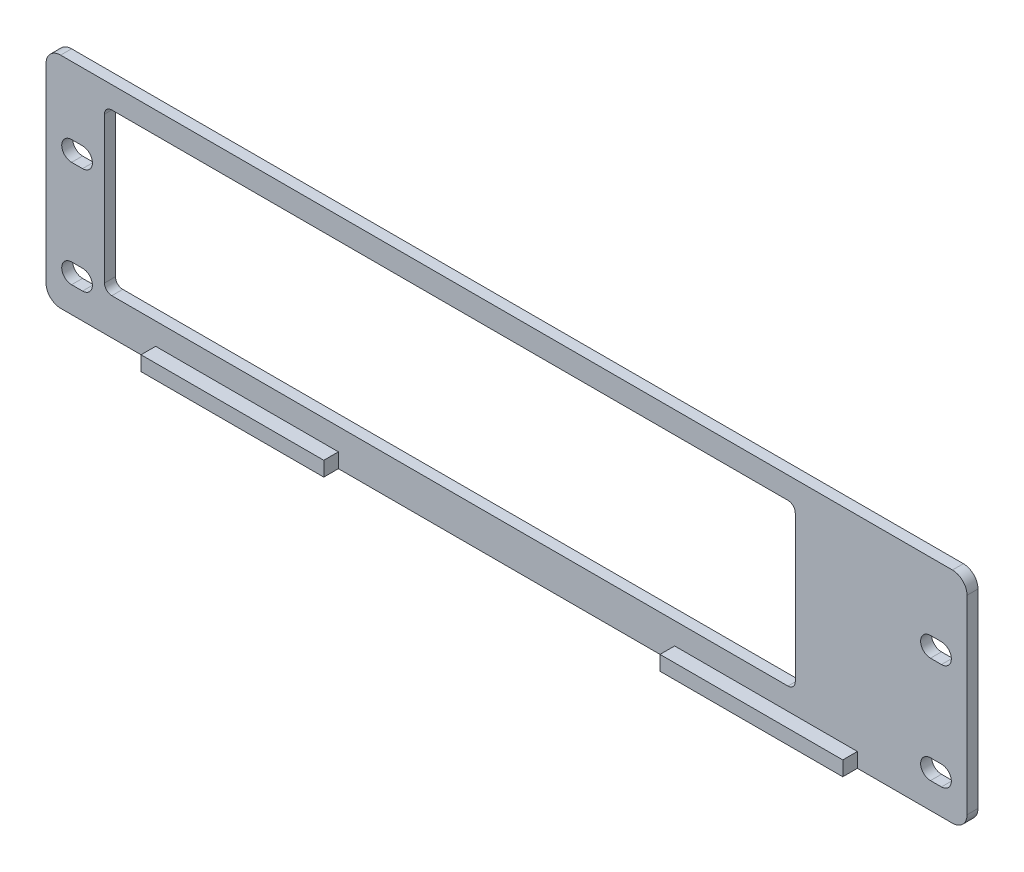
from build123d import *

# Parameters (mm, degrees)
SKETCH1_W           = 252
SKETCH1_H           = 60
BOSS_EXTRUDE1_DEPTH = 3
SKETCH3_W           = 50
SKETCH3_H           = 4
BOSS_EXTRUDE3_DEPTH = 4
SKETCH4_W           = 189
SKETCH4_H           = 44
CUT_EXTRUDE1_DEPTH  = 4
FILLET1_R           = 4
FILLET3_R           = 2


with BuildPart() as part:
    # Sketch1 → Boss-Extrude1 (new body)
    with BuildSketch(Plane.XY):
        with Locations((126, 30)):
            Rectangle(SKETCH1_W, SKETCH1_H)
        with BuildLine():
            Line((245, 36.1), (242, 36.1))
            ThreePointArc((242, 36.1), (239.3, 38.8), (242, 41.5))
            Line((242, 41.5), (245, 41.5))
            ThreePointArc((245, 41.5), (247.7, 38.8), (245, 36.1))
        make_face(mode=Mode.SUBTRACT)
        with BuildLine():
            Line((242, 12.5), (245, 12.5))
            ThreePointArc((245, 12.5), (247.7, 9.8), (245, 7.1))
            Line((245, 7.1), (242, 7.1))
            ThreePointArc((242, 7.1), (239.3, 9.8), (242, 12.5))
        make_face(mode=Mode.SUBTRACT)
        with BuildLine():
            Line((7, 41.5), (10, 41.5))
            ThreePointArc((10, 41.5), (12.7, 38.8), (10, 36.1))
            Line((10, 36.1), (7, 36.1))
            ThreePointArc((7, 36.1), (4.3, 38.8), (7, 41.5))
        make_face(mode=Mode.SUBTRACT)
        with BuildLine():
            Line((7, 12.5), (10, 12.5))
            ThreePointArc((10, 12.5), (12.7, 9.8), (10, 7.1))
            Line((10, 7.1), (7, 7.1))
            ThreePointArc((7, 7.1), (4.3, 9.8), (7, 12.5))
        make_face(mode=Mode.SUBTRACT)
    extrude(amount=BOSS_EXTRUDE1_DEPTH)

    # Sketch3 → Boss-Extrude3 (add)
    with BuildSketch(Plane.XY.offset(3)):
        with Locations((55, 2)):
            Rectangle(SKETCH3_W, SKETCH3_H)
        with Locations((197, 2)):
            Rectangle(SKETCH3_W, SKETCH3_H)
    extrude(amount=BOSS_EXTRUDE3_DEPTH)

    # Sketch4 → Cut-Extrude1 (cut)
    with BuildSketch(Plane.XY.offset(3)):
        with Locations((110.5, 32)):
            Rectangle(SKETCH4_W, SKETCH4_H)
    extrude(amount=-CUT_EXTRUDE1_DEPTH, mode=Mode.SUBTRACT)

    # Fillet1
    fillet1_edges = [part.edges().sort_by_distance(p)[0] for p in [
        (0, 60, 1.5),
        (252, 60, 1.5),
        (252, 0, 1.5),
        (0, 0, 1.5),
    ]]
    fillet(fillet1_edges, radius=FILLET1_R)

    # Fillet3
    fillet3_edges = [part.edges().sort_by_distance(p)[0] for p in [
        (205, 54, 1.5),
        (205, 10, 1.5),
        (16, 10, 1.5),
        (16, 54, 1.5),
    ]]
    fillet(fillet3_edges, radius=FILLET3_R)


solid = part.part
